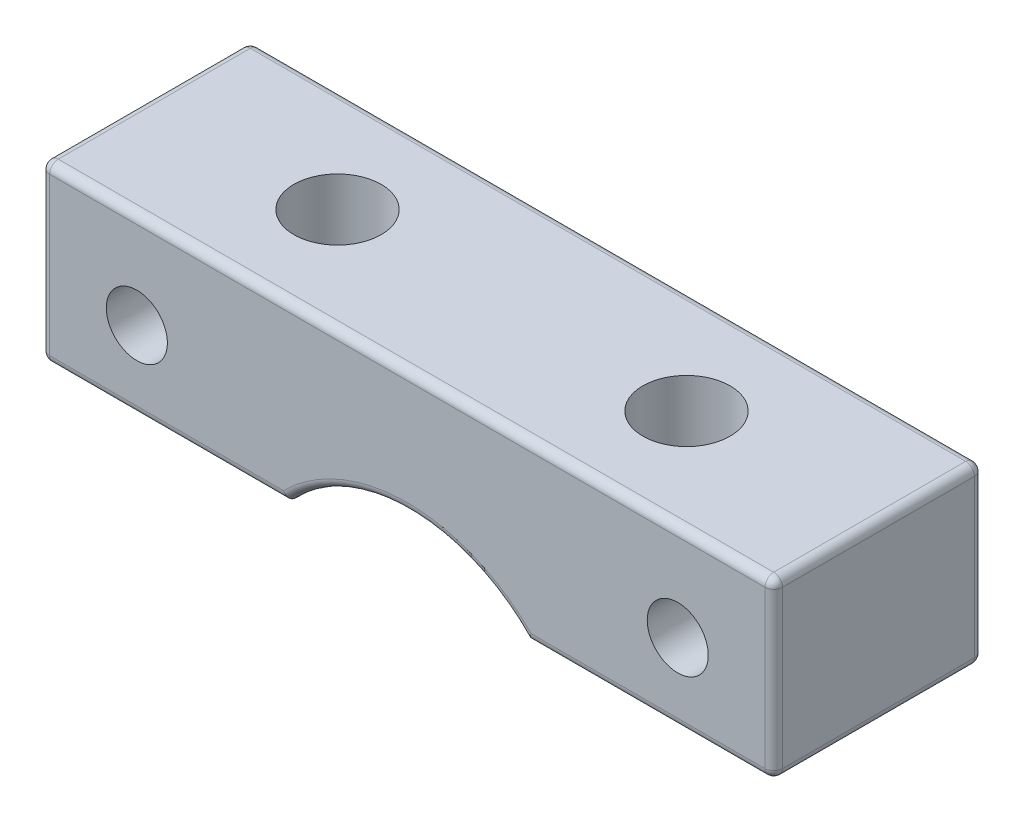
from build123d import *

# Parameters (mm, degrees)
CROQUIS1_W                              = 42
CROQUIS1_H                              = 12
SALIENTE_EXTRUIR1_DEPTH                 = 10
CORTAR_EXTRUIR1_DEPTH                   = 27.172504657
DI_METRO_DE_TALADRO_5_0_5_1_D           = 5
DI_METRO_DE_TALADRO_5_0_5_1_CSINK_D     = 10.999999995
DI_METRO_DE_TALADRO_5_0_5_1_CSINK_ANGLE = 90
DI_METRO_DE_TALADRO_3_5_3_5_1_D         = 3.5
REDONDEO1_R                             = 0.5


with BuildPart() as part:
    # Croquis1 → Saliente-Extruir1 (new body)
    with BuildSketch(Plane.XZ):
        with Locations((0, 6)):
            Rectangle(CROQUIS1_W, CROQUIS1_H)
    extrude(amount=-SALIENTE_EXTRUIR1_DEPTH)

    # Croquis2 → Cortar-Extruir1 (cut, through all)
    with BuildSketch(Plane(origin=(0, 0, 0), x_dir=(-1, 0, 0), z_dir=(0, 0, -1))):
        with BuildLine():
            Line((-6.883596498, 0), (6.883596498, 0))
            ThreePointArc((6.883596498, 0), (0, 2.952779272), (-6.883596498, 0))
        make_face()
    extrude(amount=-CORTAR_EXTRUIR1_DEPTH, mode=Mode.SUBTRACT)

    # Diámetro de taladro Ø5.0 (5)1 (through all)
    with Locations(Plane(origin=(0, 0, 0), x_dir=(-1, 0, 0), z_dir=(0, -1, 0))):
        with Locations((10, -6), (-10, -6)):
            CounterSinkHole(DI_METRO_DE_TALADRO_5_0_5_1_D / 2, DI_METRO_DE_TALADRO_5_0_5_1_CSINK_D / 2, counter_sink_angle=DI_METRO_DE_TALADRO_5_0_5_1_CSINK_ANGLE)

    # Diámetro de taladro Ø3.5 (3.5)1 (through all)
    with Locations(Plane(origin=(0, 0, 0), x_dir=(-1, 0, 0), z_dir=(0, 0, -1))):
        with Locations((15.5, 4.5), (-15.5, 4.5)):
            Hole(DI_METRO_DE_TALADRO_3_5_3_5_1_D / 2)

    # Redondeo1
    redondeo1_edges = [part.edges().sort_by_distance(p)[0] for p in [
        (21, 10, 6),
        (13.941798249, 0, 0),
        (-13.941798249, 0, 12),
        (0, 10, 12),
        (0, 2.952779272, 12),
        (0, 2.952779272, 0),
        (-21, 10, 6),
        (13.941798249, 0, 12),
        (21, 0, 6),
        (-13.941798249, 0, 0),
        (-21, 0, 6),
        (-21, 5, 12),
        (21, 5, 12),
        (21, 5, 0),
        (-21, 5, 0),
        (0, 10, 0),
    ]]
    fillet(redondeo1_edges, radius=REDONDEO1_R)


solid = part.part
